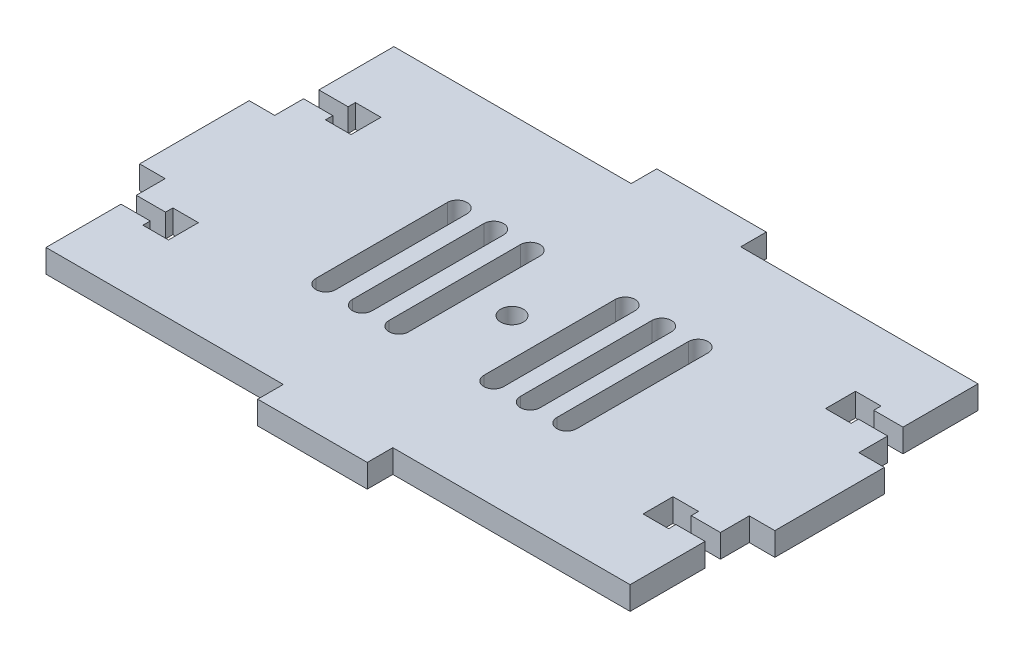
from build123d import *

# Parameters (mm, degrees)
SKETCH2_W               = 80
SKETCH2_H               = 47.65
BOSS_EXTRUDE1_DEPTH     = 3.175
SKETCH3_W               = 15
SKETCH3_H               = 3.5
BOSS_EXTRUDE2_DEPTH     = 3.175
SKETCH4_W               = 3.5
SKETCH4_H               = 15
BOSS_EXTRUDE3_DEPTH     = 3.175
MIRROR2_COPY_1_SKETCH_W = 3.5
MIRROR2_COPY_1_SKETCH_H = 15
MIRROR2_COPY_1_DEPTH    = 3.175
MIRROR2_COPY_2_SKETCH_W = 3.5
MIRROR2_COPY_2_SKETCH_H = 15
MIRROR2_COPY_2_DEPTH    = 3.175
CUT_EXTRUDE1_DEPTH      = 10
MIRROR4_COPY_1_DEPTH    = 10
CUT_EXTRUDE2_DEPTH      = 10
LPATTERN1_COUNT         = 3
LPATTERN1_PITCH         = 5
MIRROR5_COPY_1_DEPTH    = 10
MIRROR5_COPY_2_DEPTH    = 10
CUT_EXTRUDE6_DEPTH      = 52.468303353
CUT_EXTRUDE6_DEPTH_BACK = 52.468303353
SKETCH7_R               = 1.55


with BuildPart() as part:
    # Sketch2 → Boss-Extrude1 (new body)
    with BuildSketch(Plane(origin=(0, 0, 0), x_dir=(1, 0, 0), z_dir=(0, 1, 0))):
        Rectangle(SKETCH2_W, SKETCH2_H)
    extrude(amount=BOSS_EXTRUDE1_DEPTH)

    # Sketch3 → Boss-Extrude2 (add)
    with BuildSketch(Plane(origin=(0, 3.175, 0), x_dir=(1, 0, 0), z_dir=(0, 1, 0))):
        with Locations((0, 25.575)):
            Rectangle(SKETCH3_W, SKETCH3_H)
    boss_extrude2 = extrude(amount=-BOSS_EXTRUDE2_DEPTH)

    # Sketch4 → Boss-Extrude3 (add)
    with BuildSketch(Plane(origin=(0, 3.175, 0), x_dir=(1, 0, 0), z_dir=(0, 1, 0))):
        with Locations((-41.75, 0)):
            Rectangle(SKETCH4_W, SKETCH4_H)
    boss_extrude3 = extrude(amount=-BOSS_EXTRUDE3_DEPTH)

    # Mirror1: Boss-Extrude3 across plane
    add(boss_extrude3.mirror(Plane(origin=(0, 0, 0), x_dir=(0, 0, 1), z_dir=(1, 0, 0))))

    # Mirror2: Boss-Extrude2 across plane
    add(boss_extrude2.mirror(Plane.XY))

    # Mirror2 copy 1 sketch → Mirror2 copy 1 (add)
    with BuildSketch(Plane(origin=(0, 3.175, 0), x_dir=(-1, 0, 0), z_dir=(0, 1, 0))):
        with Locations((-41.75, 0)):
            Rectangle(MIRROR2_COPY_1_SKETCH_W, MIRROR2_COPY_1_SKETCH_H)
    extrude(amount=-MIRROR2_COPY_1_DEPTH)

    # Mirror2 copy 2 sketch → Mirror2 copy 2 (add)
    with BuildSketch(Plane(origin=(0, 3.175, 0), x_dir=(1, 0, 0), z_dir=(0, 1, 0))):
        with Locations((-41.75, 0)):
            Rectangle(MIRROR2_COPY_2_SKETCH_W, MIRROR2_COPY_2_SKETCH_H)
    extrude(amount=-MIRROR2_COPY_2_DEPTH)

    # Sketch5 → Cut-Extrude1 (cut)
    with BuildSketch(Plane(origin=(0, 3.175, 0), x_dir=(1, 0, 0), z_dir=(0, 1, 0))):
        Polygon((-40, 13.55), (-36, 13.55), (-36, 14.55), (-32.5, 14.55), (-32.5, 10.45), (-36, 10.45), (-36, 11.45), (-40, 11.45), align=None)
    cut_extrude1 = extrude(amount=-CUT_EXTRUDE1_DEPTH, mode=Mode.SUBTRACT)

    # Mirror3: Cut-Extrude1 across plane
    add(cut_extrude1.mirror(Plane.XY), mode=Mode.SUBTRACT)

    # Mirror4: Cut-Extrude1 across plane
    add(cut_extrude1.mirror(Plane(origin=(0, 0, 0), x_dir=(0, 0, 1), z_dir=(1, 0, 0))), mode=Mode.SUBTRACT)

    # Mirror4 copy 1 sketch → Mirror4 copy 1 (cut)
    with BuildSketch(Plane(origin=(0, 3.175, 0), x_dir=(-1, 0, 0), z_dir=(0, 1, 0))):
        Polygon((-40, 13.55), (-36, 13.55), (-36, 14.55), (-32.5, 14.55), (-32.5, 10.45), (-36, 10.45), (-36, 11.45), (-40, 11.45), align=None)
    extrude(amount=-MIRROR4_COPY_1_DEPTH, mode=Mode.SUBTRACT)

    # Sketch6 → Cut-Extrude2 (cut)
    with BuildSketch(Plane(origin=(0, 3.175, 0), x_dir=(1, 0, 0), z_dir=(0, 1, 0))):
        with BuildLine():
            Line((5.15, -9), (5.15, 9))
            ThreePointArc((5.15, 9), (6.5, 10.35), (7.85, 9))
            Line((7.85, 9), (7.85, -9))
            ThreePointArc((7.85, -9), (6.5, -10.35), (5.15, -9))
        make_face()
    cut_extrude2 = extrude(amount=-CUT_EXTRUDE2_DEPTH, mode=Mode.SUBTRACT)

    # LPattern1: Cut-Extrude2 ×3
    with Locations(*[(i * LPATTERN1_PITCH, 0, 0) for i in range(1, LPATTERN1_COUNT)]):
        add(cut_extrude2, mode=Mode.SUBTRACT)

    # Mirror5: Cut-Extrude2 across plane
    add(cut_extrude2.mirror(Plane(origin=(0, 0, 0), x_dir=(0, 0, 1), z_dir=(1, 0, 0))), mode=Mode.SUBTRACT)

    # Mirror5 copy 1 sketch → Mirror5 copy 1 (cut)
    with BuildSketch(Plane(origin=(-5, 3.175, 0), x_dir=(-1, 0, 0), z_dir=(0, 1, 0))):
        with BuildLine():
            Line((5.15, 9), (5.15, -9))
            ThreePointArc((5.15, -9), (6.5, -10.35), (7.85, -9))
            Line((7.85, -9), (7.85, 9))
            ThreePointArc((7.85, 9), (6.5, 10.35), (5.15, 9))
        make_face()
    extrude(amount=-MIRROR5_COPY_1_DEPTH, mode=Mode.SUBTRACT)

    # Mirror5 copy 2 sketch → Mirror5 copy 2 (cut)
    with BuildSketch(Plane(origin=(-10, 3.175, 0), x_dir=(-1, 0, 0), z_dir=(0, 1, 0))):
        with BuildLine():
            Line((5.15, 9), (5.15, -9))
            ThreePointArc((5.15, -9), (6.5, -10.35), (7.85, -9))
            Line((7.85, -9), (7.85, 9))
            ThreePointArc((7.85, 9), (6.5, 10.35), (5.15, 9))
        make_face()
    extrude(amount=-MIRROR5_COPY_2_DEPTH, mode=Mode.SUBTRACT)

    # Sketch7 → Cut-Extrude6 (cut, two sides: drawn at the far end of the back side and taken through both)
    with BuildSketch(Plane(origin=(0, 0, 0), x_dir=(1, 0, 0), z_dir=(0, 1, 0)).offset(-CUT_EXTRUDE6_DEPTH_BACK)):
        with Locations(Location((0, 0, 0), (0, 0, 270))):
            Circle(SKETCH7_R)
    extrude(amount=CUT_EXTRUDE6_DEPTH + CUT_EXTRUDE6_DEPTH_BACK, mode=Mode.SUBTRACT)


solid = part.part
